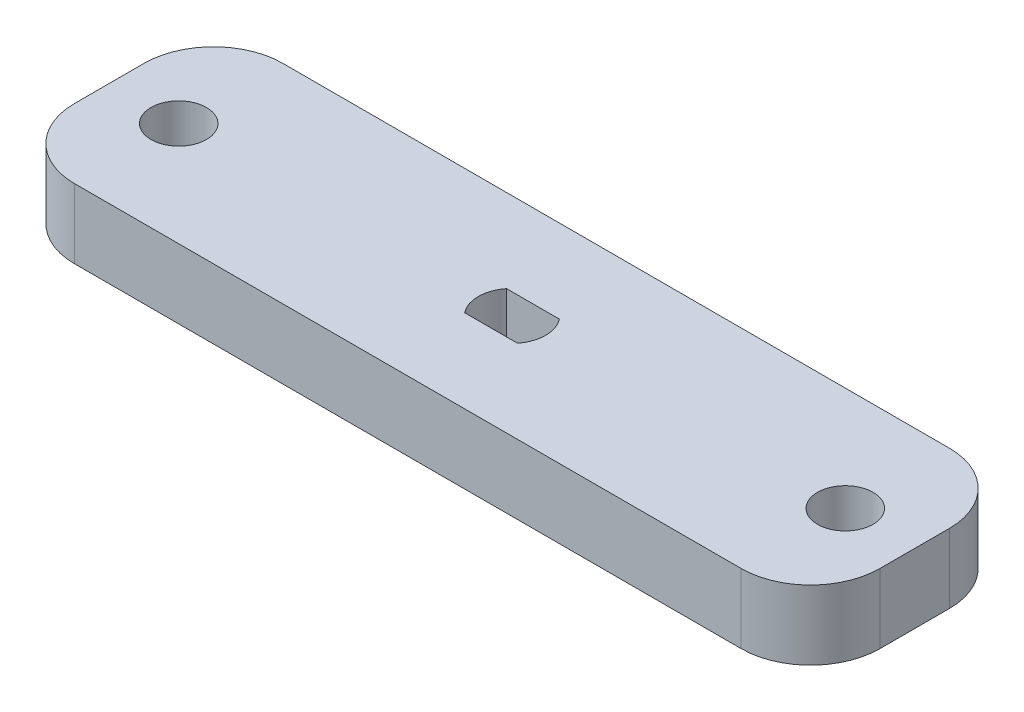
from build123d import *

# Parameters (mm, degrees)
SKETCH1_W           = 58
SKETCH1_H           = 15
SKETCH1_R           = 2
BOSS_EXTRUDE1_DEPTH = 5
FILLET1_R           = 5


with BuildPart() as part:
    # Sketch1 → Boss-Extrude1 (new body)
    with BuildSketch(Plane(origin=(0, 0, 0), x_dir=(1, 0, 0), z_dir=(0, 1, 0))):
        Rectangle(SKETCH1_W, SKETCH1_H)
        with Locations(Location((24, 0, 0), (0, 0, 270))):
            Circle(SKETCH1_R, mode=Mode.SUBTRACT)
        with Locations(Location((-24, 0, 0), (0, 0, 90))):
            Circle(SKETCH1_R, mode=Mode.SUBTRACT)
        with BuildLine():
            Line((1.9, -1.506859317), (-1.9, -1.506859317))
            ThreePointArc((-1.9, -1.506859317), (-2.425, 0), (-1.9, 1.506859317))
            Line((-1.9, 1.506859317), (1.9, 1.506859317))
            ThreePointArc((1.9, 1.506859317), (2.425, 0), (1.9, -1.506859317))
        make_face(mode=Mode.SUBTRACT)
    extrude(amount=BOSS_EXTRUDE1_DEPTH)

    # Fillet1
    fillet1_edges = [part.edges().sort_by_distance(p)[0] for p in [
        (29, 2.5, 7.5),
        (-29, 2.5, 7.5),
        (-29, 2.5, -7.5),
        (29, 2.5, -7.5),
    ]]
    fillet(fillet1_edges, radius=FILLET1_R)


solid = part.part
